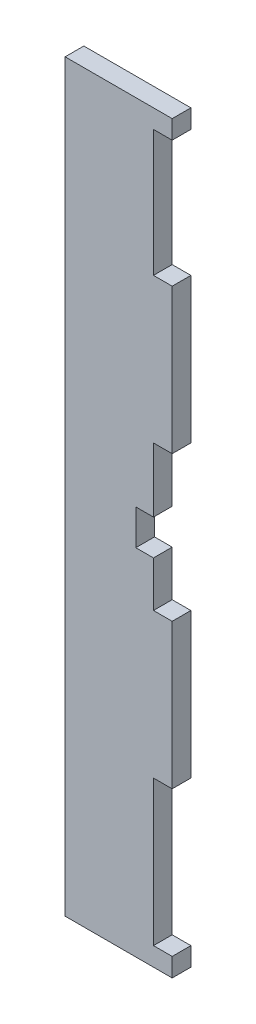
from build123d import *

# Parameters (mm, degrees)
BOSS_EXTRUDE1_DEPTH = 3.175
CUT_EXTRUDE2_REACH  = 132.832
SKETCH2_W           = 3
SKETCH2_H           = 6


with BuildPart() as part:
    # Sketch1 → Boss-Extrude1 (new body)
    with BuildSketch(Plane.XY):
        Polygon((0, 3.175), (15, 3.175), (18.175, 3.175), (18.175, 6.35), (15, 6.35), (15, 30.985), (18.175, 30.985), (18.175, 55.62), (15, 55.62), (15, 80.255), (18.175, 80.255), (18.175, 104.89), (15, 104.89), (15, 126.35), (18.175, 126.35), (18.175, 129.525), (15, 129.525), (0, 129.525), align=None)
    extrude(amount=BOSS_EXTRUDE1_DEPTH)

    # Sketch2 → Cut-Extrude2 (cut, up to next)
    with BuildSketch(Plane(origin=(0, 0, 0), x_dir=(-1, 0, 0), z_dir=(0, 0, -1)), mode=Mode.PRIVATE) as cut_extrude2_sk1:
        with Locations((-13.5, 66.35)):
            Rectangle(SKETCH2_W, SKETCH2_H)
    cut_extrude2_tool1 = extrude(cut_extrude2_sk1.sketch, amount=-CUT_EXTRUDE2_REACH, mode=Mode.PRIVATE) & part.part
    add(cut_extrude2_tool1.solids().sort_by_distance((13.5, 66.35, 0))[0], mode=Mode.SUBTRACT)


solid = part.part
